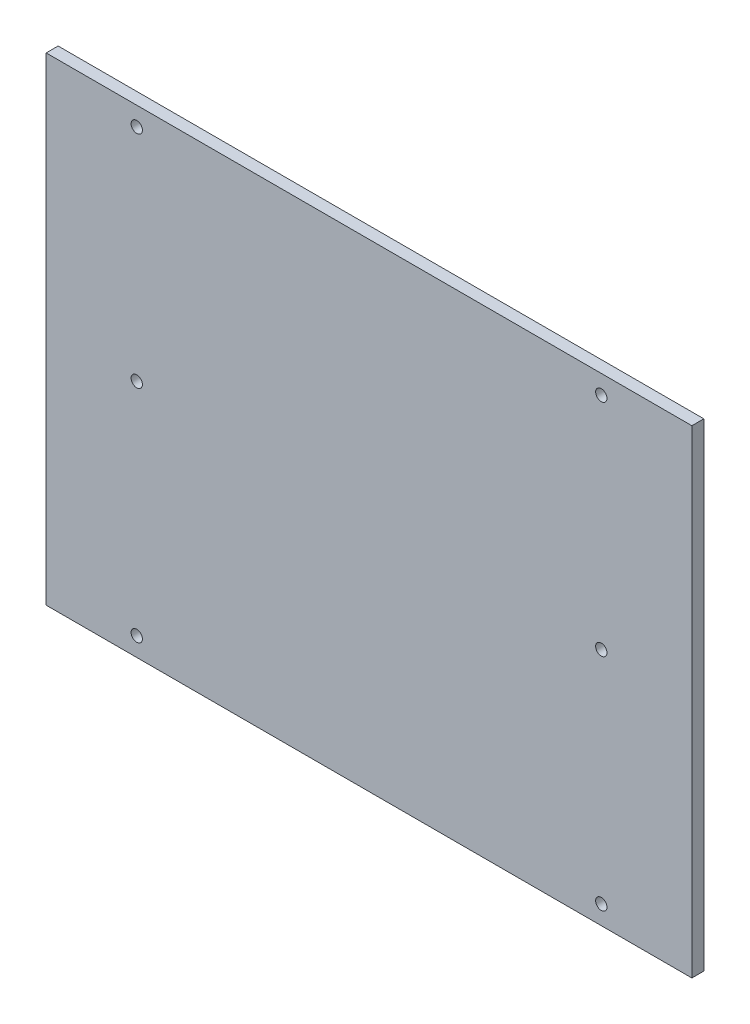
from build123d import *

# Parameters (mm, degrees)
SKETCH1_W           = 133.35
SKETCH1_H           = 127
SKETCH1_R           = 1.5
BOSS_EXTRUDE1_DEPTH = 3.175
SKETCH3_W           = 19.05
SKETCH3_H           = 127
BOSS_EXTRUDE2_DEPTH = 3.175


with BuildPart() as part:
    # Sketch1 → Boss-Extrude1 (new body)
    with BuildSketch(Plane.XY):
        with Locations((66.675, 63.5)):
            Rectangle(SKETCH1_W, SKETCH1_H)
        with Locations((5, 5)):
            Circle(SKETCH1_R, mode=Mode.SUBTRACT)
        with Locations(Location((5, 122, 0), (0, 0, 180))):
            Circle(SKETCH1_R, mode=Mode.SUBTRACT)
        with Locations((5, 63.5)):
            Circle(SKETCH1_R, mode=Mode.SUBTRACT)
        with Locations((128.35, 122)):
            Circle(SKETCH1_R, mode=Mode.SUBTRACT)
        with Locations(Location((128.35, 63.5, 0), (0, 0, 180))):
            Circle(SKETCH1_R, mode=Mode.SUBTRACT)
        with Locations(Location((128.35, 5, 0), (0, 0, 180))):
            Circle(SKETCH1_R, mode=Mode.SUBTRACT)
    extrude(amount=BOSS_EXTRUDE1_DEPTH)

    # Sketch3 → Boss-Extrude2 (add)
    with BuildSketch(Plane.XY.offset(3.175)):
        with Locations((-9.525, 63.5)):
            Rectangle(SKETCH3_W, SKETCH3_H)
        with Locations((142.875, 63.5)):
            Rectangle(SKETCH3_W, SKETCH3_H)
    extrude(amount=-BOSS_EXTRUDE2_DEPTH)


solid = part.part
